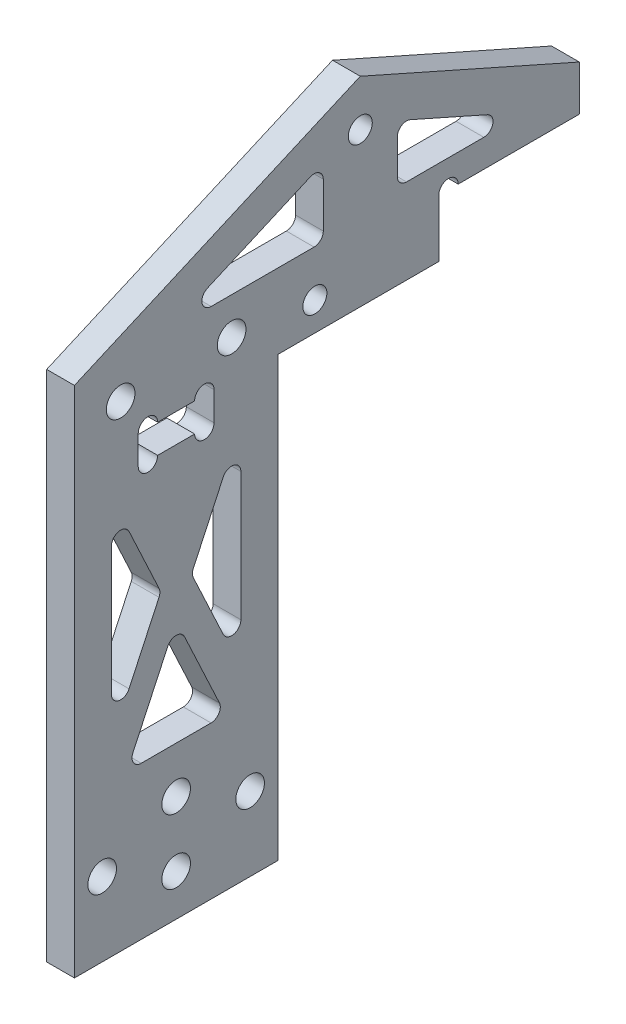
from build123d import *

# Parameters (mm, degrees)
SKETCH_1_R          = 1.55
SKETCH_1_R_2        = 1.3
EXTRUDE_1_DEPTH     = 3
FILLET_1_R          = 1
SKETCH_2_W          = 7.568949752
SKETCH_2_H          = 24.928305666
CUT_EXTRUDE_1_DEPTH = 10


with BuildPart() as part:
    # 草图1 → 凸台-拉伸1 (new body)
    with BuildSketch(Plane(origin=(0, 0, 0), x_dir=(0, 0, -1), z_dir=(1, 0, 0))):
        with BuildLine():
            Line((-11, -27.75), (11, -27.75))
            Line((11, -27.75), (11, 19.65))
            Line((11, 19.65), (28.4, 19.65))
            Line((28.4, 19.65), (28.4, 25.85))
            ThreePointArc((28.4, 25.85), (29.45, 26.9), (30.5, 25.85))
            Line((30.5, 25.85), (43.6, 25.85))
            Line((43.6, 25.85), (43.6, 19.65))
            Line((43.6, 19.65), (45.6, 19.65))
            Line((45.6, 19.65), (45.6, 29.85))
            Line((45.6, 29.85), (19.913066695, 41.248539803))
            Line((19.913066695, 41.248539803), (-11, 27.75))
            Line((-11, 27.75), (-11, -27.75))
        make_face()
        with Locations((-8, -19.75)):
            Circle(SKETCH_1_R, mode=Mode.SUBTRACT)
        with Locations((0, -23.25)):
            Circle(SKETCH_1_R, mode=Mode.SUBTRACT)
        with Locations((0, -16.25)):
            Circle(SKETCH_1_R, mode=Mode.SUBTRACT)
        with Locations((8, -19.75)):
            Circle(SKETCH_1_R, mode=Mode.SUBTRACT)
        Polygon((5.344705464, -11.25), (-5.344705464, -11.25), (0, 0.202940281), align=None, mode=Mode.SUBTRACT)
        Polygon((-7, -7.702940281), (-7, 15.202940281), (-1.655294536, 3.75), align=None, mode=Mode.SUBTRACT)
        Polygon((7, 15.202940281), (7, -7.702940281), (1.655294536, 3.75), align=None, mode=Mode.SUBTRACT)
        with Locations((-6, 23.75)):
            Circle(SKETCH_1_R, mode=Mode.SUBTRACT)
        with BuildLine():
            Line((2, 16.7), (-2, 16.7))
            ThreePointArc((-2, 16.7), (-3.05, 15.65), (-4.1, 16.7))
            Line((-4.1, 16.7), (-4.1, 19.8))
            ThreePointArc((-4.1, 19.8), (-3.05, 20.85), (-2, 19.8))
            Line((-2, 19.8), (2, 19.8))
            ThreePointArc((2, 19.8), (3.05, 20.85), (4.1, 19.8))
            Line((4.1, 19.8), (4.1, 16.7))
            ThreePointArc((4.1, 16.7), (3.05, 15.65), (2, 16.7))
        make_face(mode=Mode.SUBTRACT)
        with Locations((6, 23.75)):
            Circle(SKETCH_1_R, mode=Mode.SUBTRACT)
        with Locations((15, 22.75)):
            Circle(SKETCH_1_R_2, mode=Mode.SUBTRACT)
        Polygon((11, 27.75), (-1.004338059, 27.75), (15.913066695, 35.137175905), (15.913066695, 27.75), align=None, mode=Mode.SUBTRACT)
        Polygon((23.913066695, 28.85), (23.913066695, 35.097405162), (37.991771729, 28.85), align=None, mode=Mode.SUBTRACT)
        with Locations((19.913066695, 36.248539803)):
            Circle(SKETCH_1_R_2, mode=Mode.SUBTRACT)
    extrude(amount=EXTRUDE_1_DEPTH)

    # 圆角1
    fillet_1_edges = [part.edges().sort_by_distance(p)[0] for p in [
        (1.5, 35.097405162, -23.913066695),
        (1.5, 28.85, -23.913066695),
        (1.5, 28.85, -37.991771729),
        (1.5, 35.137175905, -15.913066695),
        (1.5, 27.75, 1.004338059),
        (1.5, 27.75, -15.913066695),
        (1.5, 15.202940281, 7),
        (1.5, -7.702940281, 7),
        (1.5, 3.75, 1.655294536),
        (1.5, -7.702940281, -7),
        (1.5, 15.202940281, -7),
        (1.5, 3.75, -1.655294536),
        (1.5, -11.25, 5.344705464),
        (1.5, -11.25, -5.344705464),
        (1.5, 0.202940281, 0),
    ]]
    fillet(fillet_1_edges, radius=FILLET_1_R)

    # 草图2 → 切除-拉伸1 (cut)
    with BuildSketch(Plane(origin=(3, 0, 0), x_dir=(0, 0, -1), z_dir=(1, 0, 0))):
        with Locations((47.384474876, 32.114152833)):
            Rectangle(SKETCH_2_W, SKETCH_2_H)
    extrude(amount=-CUT_EXTRUDE_1_DEPTH, mode=Mode.SUBTRACT)


solid = part.part
